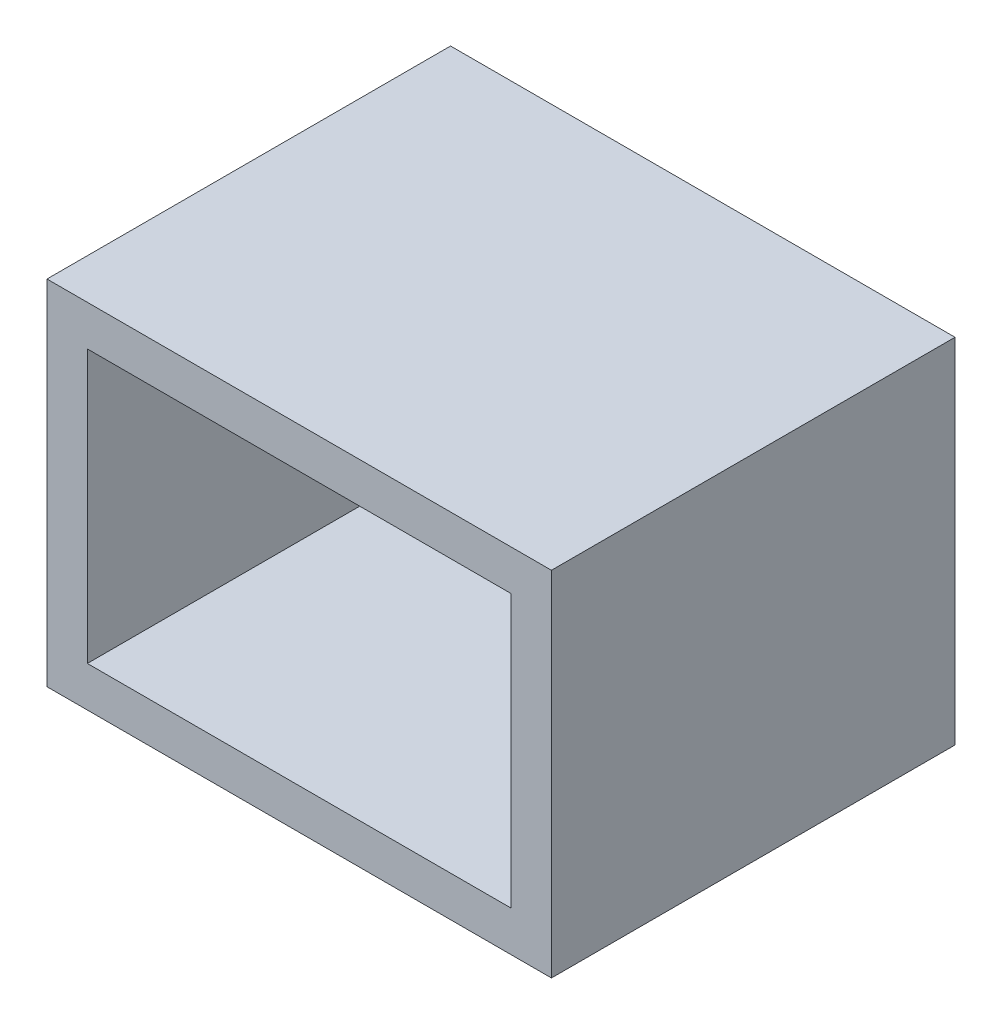
from build123d import *

# Parameters (mm, degrees)
SKETCH1_W           = 50
SKETCH1_H           = 40
BOSS_EXTRUDE1_DEPTH = 35
SKETCH2_W           = 42
SKETCH2_H           = 27
CUT_EXTRUDE1_DEPTH  = 59.736700622


with BuildPart() as part:
    # Sketch1 → Boss-Extrude1 (new body)
    with BuildSketch(Plane(origin=(0, 0, 0), x_dir=(1, 0, 0), z_dir=(0, 1, 0))):
        Rectangle(SKETCH1_W, SKETCH1_H)
    extrude(amount=BOSS_EXTRUDE1_DEPTH)

    # Sketch2 → Cut-Extrude1 (cut, through all)
    with BuildSketch(Plane.XY.offset(20)):
        with Locations((0, 17.5)):
            Rectangle(SKETCH2_W, SKETCH2_H)
    extrude(amount=-CUT_EXTRUDE1_DEPTH, mode=Mode.SUBTRACT)


solid = part.part
